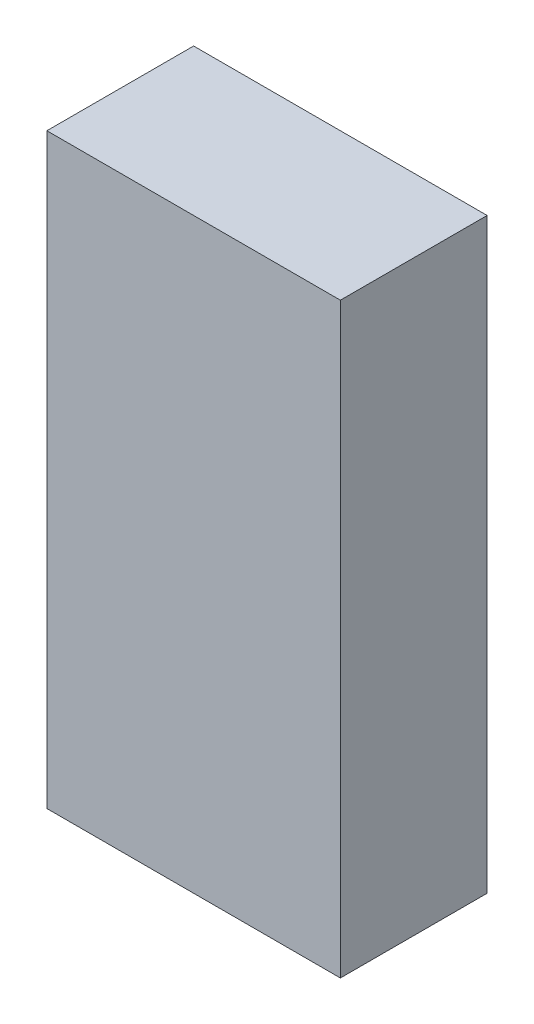
from build123d import *

# Parameters (mm, degrees)
CROQUIS1_W              = 25.4
CROQUIS1_H              = 50.8
SALIENTE_EXTRUIR1_DEPTH = 12.7


with BuildPart() as part:
    # Croquis1 → Saliente-Extruir1 (new body)
    with BuildSketch(Plane.XY):
        Rectangle(CROQUIS1_W, CROQUIS1_H)
    extrude(amount=SALIENTE_EXTRUIR1_DEPTH)


solid = part.part
